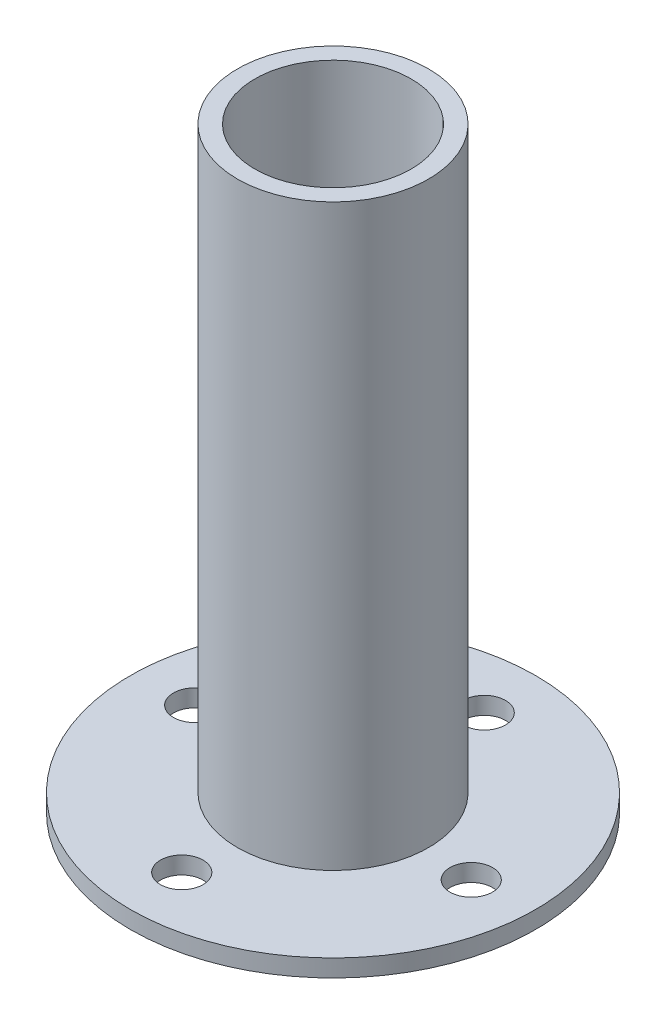
from build123d import *

# Parameters (mm, degrees)
SKETCH1_R           = 35
BOSS_EXTRUDE1_DEPTH = 3
SKETCH2_R           = 14
CUT_EXTRUDE1_DEPTH  = 6
SKETCH3_R           = 3.676124065
CUT_EXTRUDE2_DEPTH  = 6
CIRPATTERN1_COUNT   = 4
SKETCH4_R           = 16.5
SKETCH4_R_2         = 13.5
EXTRUDE_THIN1_DEPTH = 100


with BuildPart() as part:
    # Sketch1 → Boss-Extrude1 (new body)
    with BuildSketch(Plane(origin=(0, 0, 0), x_dir=(1, 0, 0), z_dir=(0, 1, 0))):
        with Locations(Location((0, 0, 0), (0, 0, 270))):
            Circle(SKETCH1_R)
    extrude(amount=BOSS_EXTRUDE1_DEPTH)

    # Sketch2 → Cut-Extrude1 (cut)
    with BuildSketch(Plane(origin=(0, 3, 0), x_dir=(1, 0, 0), z_dir=(0, 1, 0))):
        with Locations(Location((0, 0, 0), (0, 0, 270))):
            Circle(SKETCH2_R)
    extrude(amount=-CUT_EXTRUDE1_DEPTH, mode=Mode.SUBTRACT)

    # Sketch3 → Cut-Extrude2 (cut)
    with BuildSketch(Plane(origin=(0, 3, 0), x_dir=(1, 0, 0), z_dir=(0, 1, 0))):
        with Locations(Location((1.119457284, 25, 0), (0, 0, 270))):
            Circle(SKETCH3_R)
    cut_extrude2 = extrude(amount=-CUT_EXTRUDE2_DEPTH, mode=Mode.SUBTRACT)

    # CirPattern1: Cut-Extrude2 ×4 about axis
    cirpattern1_axis = Axis((0, 0, 0), (0, 1, 0))
    for i in range(1, CIRPATTERN1_COUNT):
        add(cut_extrude2.rotate(cirpattern1_axis, i * 360 / CIRPATTERN1_COUNT), mode=Mode.SUBTRACT)


with BuildPart() as body_2:
    # Sketch4 → Extrude-Thin1 (new body)
    with BuildSketch(Plane(origin=(0, 3, 0), x_dir=(1, 0, 0), z_dir=(0, 1, 0))):
        Circle(SKETCH4_R)
        Circle(SKETCH4_R_2, mode=Mode.SUBTRACT)
    extrude(amount=EXTRUDE_THIN1_DEPTH)


solid = Compound([part.part, body_2.part])
